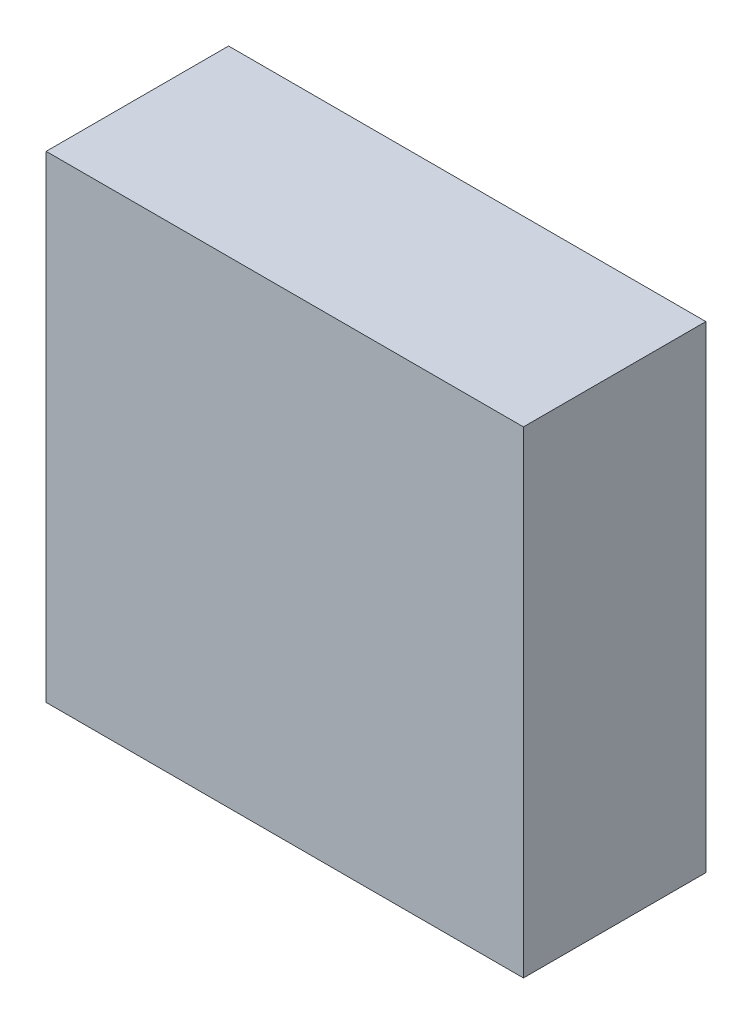
from build123d import *

# Parameters (mm, degrees)
SKIZZE1_W               = 2.6162
SKIZZE1_H               = 2.6162
COMPONENT_OUTLINE_DEPTH = 1


with BuildPart() as part:
    # Skizze1 → Component_Outline (new body)
    with BuildSketch(Plane.XY):
        with Locations((0.0381, 0.0381)):
            Rectangle(SKIZZE1_W, SKIZZE1_H)
    extrude(amount=COMPONENT_OUTLINE_DEPTH)


solid = part.part
